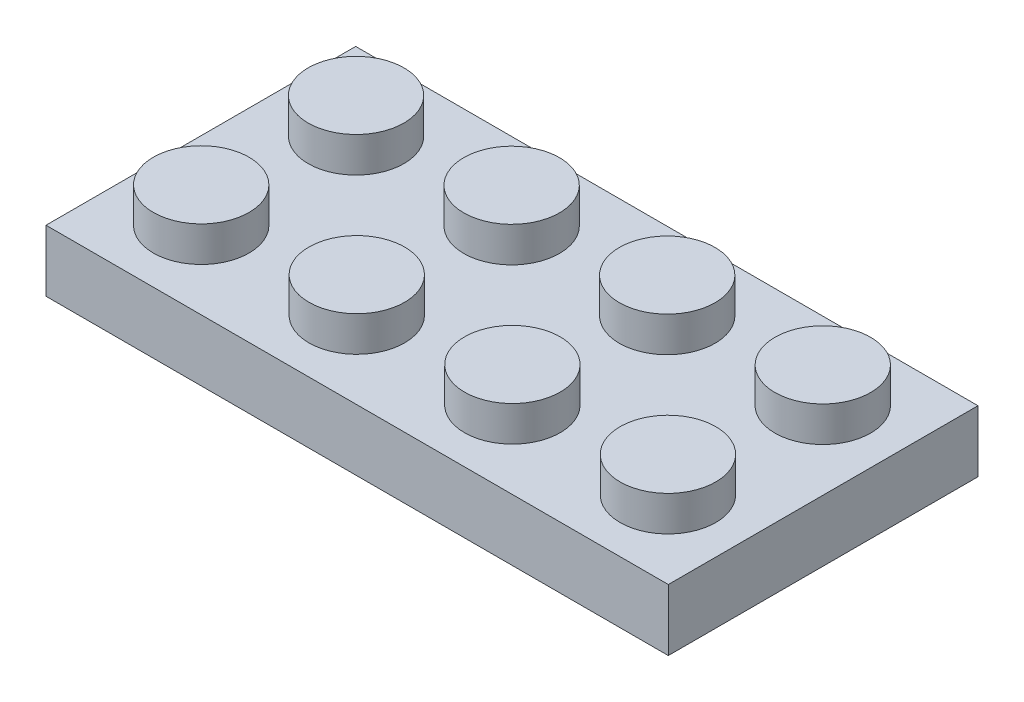
from build123d import *

# Parameters (mm, degrees)
SKETCH1_W           = 31.85
SKETCH1_H           = 15.85
BOSS_EXTRUDE1_DEPTH = 3.15
SKETCH2_R           = 2.45
BOSS_EXTRUDE2_DEPTH = 1.8
SHELL1_T            = -1.5
SKETCH3_R           = 3.23
SKETCH3_R_2         = 2.37
BOSS_EXTRUDE3_DEPTH = 1.45


with BuildPart() as part:
    # Sketch1 → Boss-Extrude1 (new body)
    with BuildSketch(Plane(origin=(0, 0, 0), x_dir=(1, 0, 0), z_dir=(0, 1, 0))):
        Rectangle(SKETCH1_W, SKETCH1_H)
    extrude(amount=-BOSS_EXTRUDE1_DEPTH)

    # Sketch2 → Boss-Extrude2 (add)
    with BuildSketch(Plane(origin=(0, 0, 0), x_dir=(1, 0, 0), z_dir=(0, 1, 0))):
        with Locations(Location((-11.94375, 3.9625, 0), (0, 0, 270))):
            Circle(SKETCH2_R)
        with Locations(Location((-3.98125, 3.9625, 0), (0, 0, 270))):
            Circle(SKETCH2_R)
        with Locations(Location((3.98125, 3.9625, 0), (0, 0, 270))):
            Circle(SKETCH2_R)
        with Locations(Location((11.94375, 3.9625, 0), (0, 0, 270))):
            Circle(SKETCH2_R)
        with Locations(Location((-3.98125, -3.9625, 0), (0, 0, 270))):
            Circle(SKETCH2_R)
        with Locations(Location((3.98125, -3.9625, 0), (0, 0, 270))):
            Circle(SKETCH2_R)
        with Locations(Location((11.94375, -3.9625, 0), (0, 0, 270))):
            Circle(SKETCH2_R)
        with Locations(Location((-11.94375, -3.9625, 0), (0, 0, 270))):
            Circle(SKETCH2_R)
    extrude(amount=BOSS_EXTRUDE2_DEPTH)

    # Shell1
    shell1_openings = [part.faces().sort_by_distance(p)[0] for p in [
        (0, -3.15, 0),
    ]]
    offset(amount=SHELL1_T, openings=shell1_openings, kind=Kind.INTERSECTION)

    # Sketch3 → Boss-Extrude3 (add)
    # profile 1 of 3: a face of its own
    with BuildSketch(Plane.XZ.offset(1.5)):
        with Locations(Location((0, 0, 0), (0, 0, 90))):
            Circle(SKETCH3_R)
        with Locations(Location((0, 0, 0), (0, 0, 90))):
            Circle(SKETCH3_R_2, mode=Mode.SUBTRACT)
    # profile 2 of 3: a face of its own
    with BuildSketch(Plane.XZ.offset(1.5)):
        with Locations(Location((7.9625, 0, 0), (0, 0, 90))):
            Circle(SKETCH3_R)
        with Locations(Location((7.9625, 0, 0), (0, 0, 90))):
            Circle(SKETCH3_R_2, mode=Mode.SUBTRACT)
    # profile 3 of 3: a face of its own
    with BuildSketch(Plane.XZ.offset(1.5)):
        with Locations(Location((-7.9625, 0, 0), (0, 0, 90))):
            Circle(SKETCH3_R)
        with Locations(Location((-7.9625, 0, 0), (0, 0, 90))):
            Circle(SKETCH3_R_2, mode=Mode.SUBTRACT)
    extrude(amount=BOSS_EXTRUDE3_DEPTH)


solid = part.part
